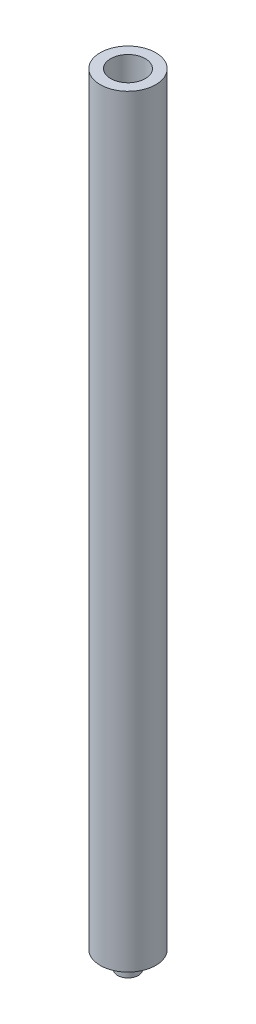
from build123d import *

# Parameters (mm, degrees)
SKETCH1_R           = 4
BOSS_EXTRUDE1_DEPTH = 40
SKETCH2_R           = 1.5
BOSS_EXTRUDE2_DEPTH = 2.5
BOSS_EXTRUDE3_START = 70
SKETCH3_R           = 4
BOSS_EXTRUDE3_DEPTH = 70
SKETCH4_R           = 2.5
CUT_EXTRUDE1_DEPTH  = 10


with BuildPart() as part:
    # Sketch1 → Boss-Extrude1 (new body)
    with BuildSketch(Plane(origin=(0, 0, 0), x_dir=(1, 0, 0), z_dir=(0, 1, 0))):
        with Locations(Location((0, 0, 0), (0, 0, 270))):
            Circle(SKETCH1_R)
    extrude(amount=-BOSS_EXTRUDE1_DEPTH)

    # Sketch2 → Boss-Extrude2 (add)
    with BuildSketch(Plane.XZ.offset(40)):
        with Locations(Location((0, 0, 0), (0, 0, 270))):
            Circle(SKETCH2_R)
    extrude(amount=BOSS_EXTRUDE2_DEPTH)

    # Sketch3 → Boss-Extrude3 (add)
    with BuildSketch(Plane(origin=(0, 0, 0), x_dir=(1, 0, 0), z_dir=(0, 1, 0)).offset(BOSS_EXTRUDE3_START)):
        with Locations(Location((0, 0, 0), (0, 0, 270))):
            Circle(SKETCH3_R)
    extrude(amount=-BOSS_EXTRUDE3_DEPTH)

    # Sketch4 → Cut-Extrude1 (cut)
    with BuildSketch(Plane(origin=(0, 70, 0), x_dir=(1, 0, 0), z_dir=(0, 1, 0))):
        with Locations(Location((0, 0, 0), (0, 0, 270))):
            Circle(SKETCH4_R)
    extrude(amount=-CUT_EXTRUDE1_DEPTH, mode=Mode.SUBTRACT)


solid = part.part
